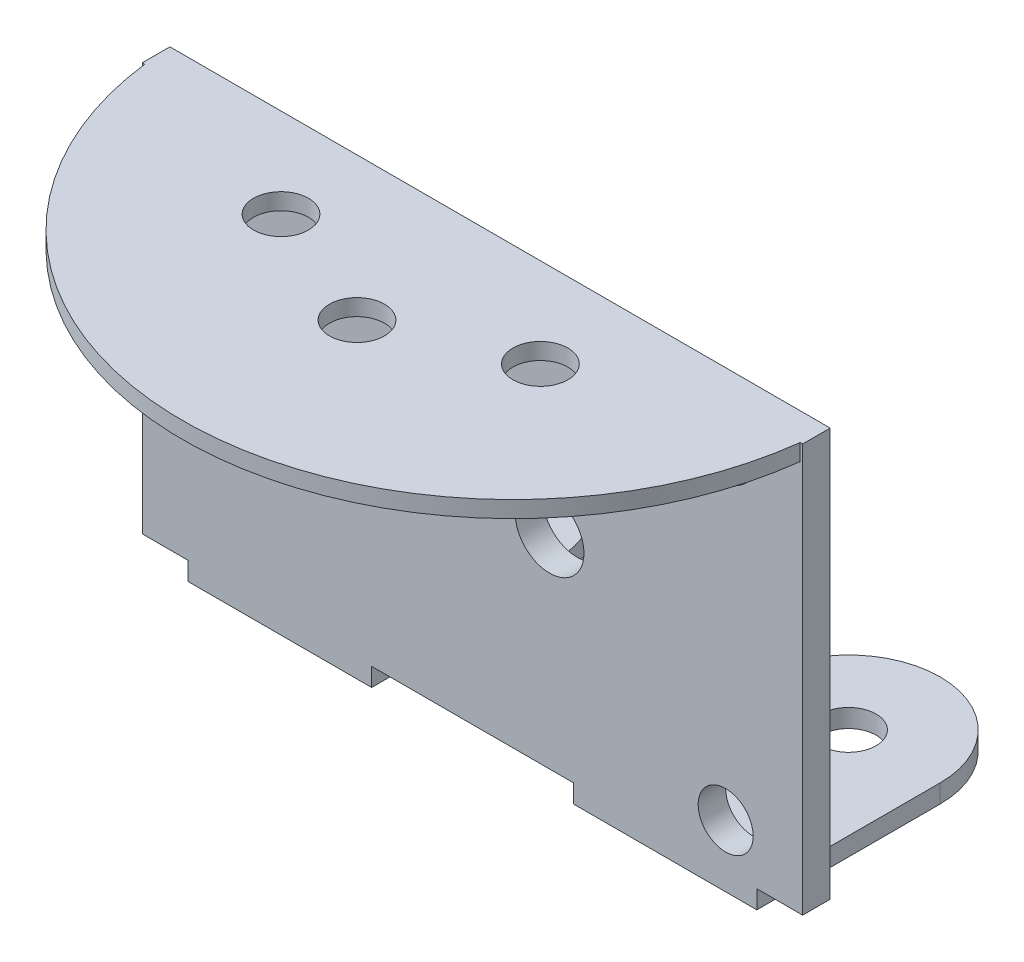
from build123d import *

# Parameters (mm, degrees)
CROQUIS1_W              = 36
CROQUIS1_H              = 22.25
CROQUIS1_R              = 1.5
CROQUIS1_R_2            = 3.05
CROQUIS1_R_3            = 1.875
SALIENTE_EXTRUIR1_DEPTH = 1.5
CROQUIS2_R              = 1.5
CROQUIS2_W              = 10
CROQUIS2_H              = 1.5
SALIENTE_EXTRUIR2_DEPTH = 1
CROQUIS3_R              = 1.500000001
CROQUIS3_R_2            = 1.5
SALIENTE_EXTRUIR6_DEPTH = 0.9


with BuildPart() as part:
    # Croquis1 → Saliente-Extruir1 (new body)
    with BuildSketch(Plane.XY):
        Rectangle(CROQUIS1_W, CROQUIS1_H)
        with Locations((13.8, 8.745)):
            Circle(CROQUIS1_R, mode=Mode.SUBTRACT)
        with Locations((-6.8, 0)):
            Circle(CROQUIS1_R_2, mode=Mode.SUBTRACT)
        with Locations(Location((13.8, -8.745, 0), (0, 0, 180))):
            Circle(CROQUIS1_R, mode=Mode.SUBTRACT)
        with Locations((4.2, 0)):
            Circle(CROQUIS1_R_3, mode=Mode.SUBTRACT)
    extrude(amount=SALIENTE_EXTRUIR1_DEPTH)

    # Croquis2 → Saliente-Extruir2 (add)
    # profile 1 of 4: a face of its own
    with BuildSketch(Plane.XZ.offset(11.125)):
        with BuildLine():
            Line((-5.5, -8.5), (-5.5, 0))
            Line((-5.5, 0), (-15.5, 0))
            Line((-15.5, 0), (-15.5, -8.5))
            ThreePointArc((-15.5, -8.5), (-10.5, -13.5), (-5.5, -8.5))
        make_face()
        with Locations((-10.5, -8.5)):
            Circle(CROQUIS2_R, mode=Mode.SUBTRACT)
    # profile 2 of 4: a face of its own
    with BuildSketch(Plane.XZ.offset(11.125)):
        with Locations((-10.5, 0.75)):
            Rectangle(CROQUIS2_W, CROQUIS2_H)
    # profile 3 of 4: a face of its own
    with BuildSketch(Plane.XZ.offset(11.125)):
        with BuildLine():
            Line((15.5, 0), (5.5, 0))
            Line((5.5, 0), (5.5, -8.5))
            ThreePointArc((5.5, -8.5), (10.5, -13.5), (15.5, -8.5))
            Line((15.5, -8.5), (15.5, 0))
        make_face()
        with Locations((10.5, -8.5)):
            Circle(CROQUIS2_R, mode=Mode.SUBTRACT)
    # profile 4 of 4: a face of its own
    with BuildSketch(Plane.XZ.offset(11.125)):
        with Locations((10.5, 0.75)):
            Rectangle(CROQUIS2_W, CROQUIS2_H)
    extrude(amount=SALIENTE_EXTRUIR2_DEPTH)

    # Croquis3 → Saliente-Extruir6 (add)
    # profile 1 of 2: a face of its own
    with BuildSketch(Plane(origin=(0, 11.125, 0), x_dir=(1, 0, 0), z_dir=(0, 1, 0))):
        with BuildLine():
            ThreePointArc((-17.865049678, -1.5), (0, -17.3), (17.865049678, -1.5))
            Line((17.865049678, -1.5), (-17.865049678, -1.5))
        make_face()
        with Locations(Location((-7.071067812, -4.871067812, 0), (0, 0, 180))):
            Circle(CROQUIS3_R, mode=Mode.SUBTRACT)
        with Locations(Location((0, -7.8, 0), (0, 0, 180))):
            Circle(CROQUIS3_R_2, mode=Mode.SUBTRACT)
        with Locations(Location((7.071067812, -4.871067812, 0), (0, 0, 180))):
            Circle(CROQUIS3_R_2, mode=Mode.SUBTRACT)
    # profile 2 of 2: a face of its own
    with BuildSketch(Plane(origin=(0, 11.125, 0), x_dir=(1, 0, 0), z_dir=(0, 1, 0))):
        with BuildLine():
            ThreePointArc((17.865049678, -1.5), (17.941399597, -0.751268579), (17.986383739, 0))
            Line((17.986383739, 0), (-17.986383739, 0))
            ThreePointArc((-17.986383739, 0), (-17.941399597, -0.751268579), (-17.865049678, -1.5))
            Line((-17.865049678, -1.5), (17.865049678, -1.5))
        make_face()
    extrude(amount=-SALIENTE_EXTRUIR6_DEPTH)


solid = part.part
